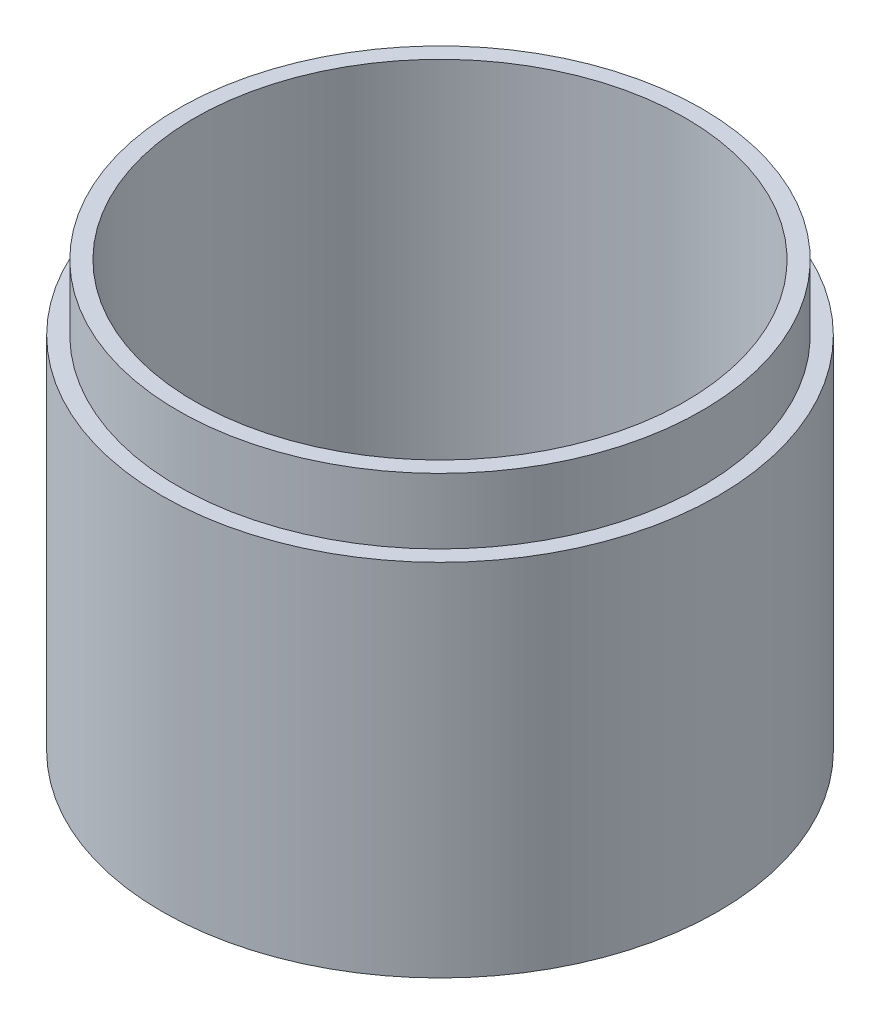
from build123d import *


with BuildPart() as part:
    # Эскиз1 → Повернуть1 (revolve)
    with BuildSketch(Plane.XY, mode=Mode.PRIVATE) as revolve_1_sk:
        Polygon((-15, 0), (-15, 26), (-16, 26), (-16, 22), (-17, 22), (-17, 0), align=None)
    revolve(revolve_1_sk.sketch.rotate(Axis((0, 0, 0), (0, 1, 0)), 270), axis=Axis((0, 0, 0), (0, 1, 0)))


solid = part.part
